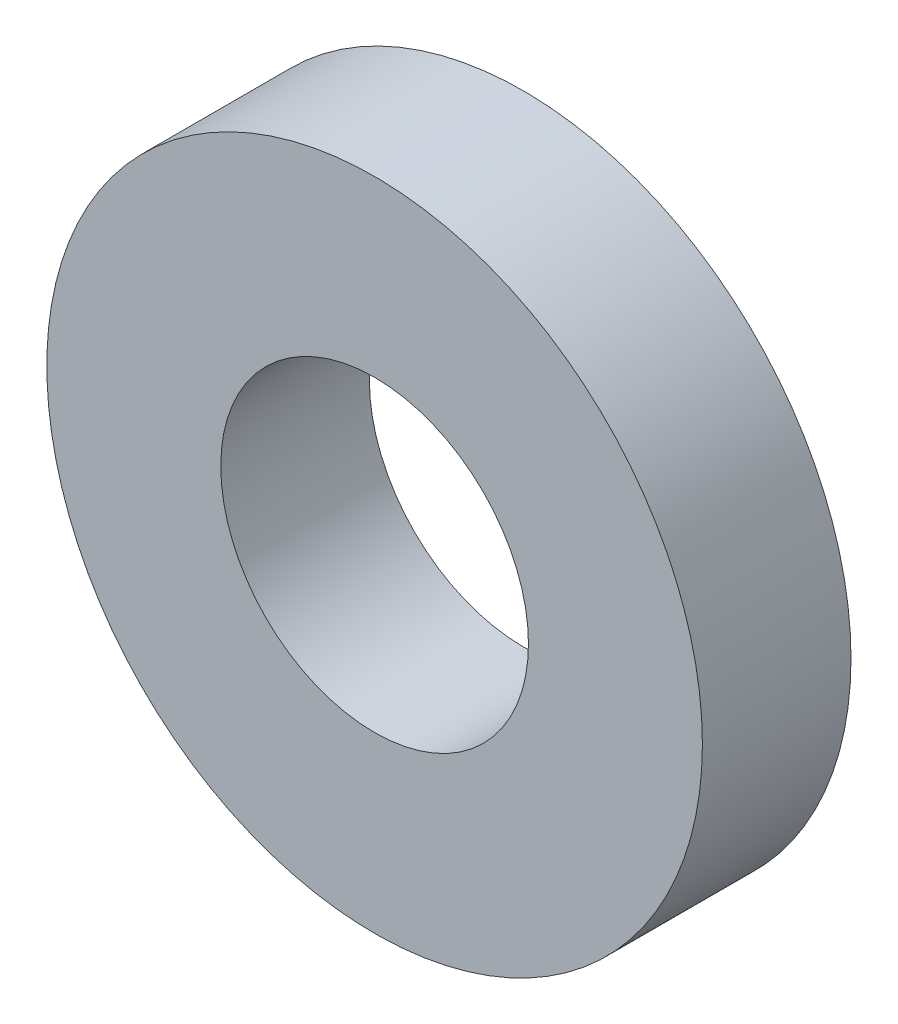
from build123d import *

# Parameters (mm, degrees)
IZIM1_R                     = 37.5
IZIM1_R_2                   = 17.6
Y_KSEKLIK_EKSTR_ZYON1_DEPTH = 8.5


with BuildPart() as part:
    # Çizim1 → Yükseklik-Ekstrüzyon1 (new, symmetric)
    with BuildSketch(Plane.XY):
        Circle(IZIM1_R)
        Circle(IZIM1_R_2, mode=Mode.SUBTRACT)
    extrude(amount=Y_KSEKLIK_EKSTR_ZYON1_DEPTH, both=True)


solid = part.part
